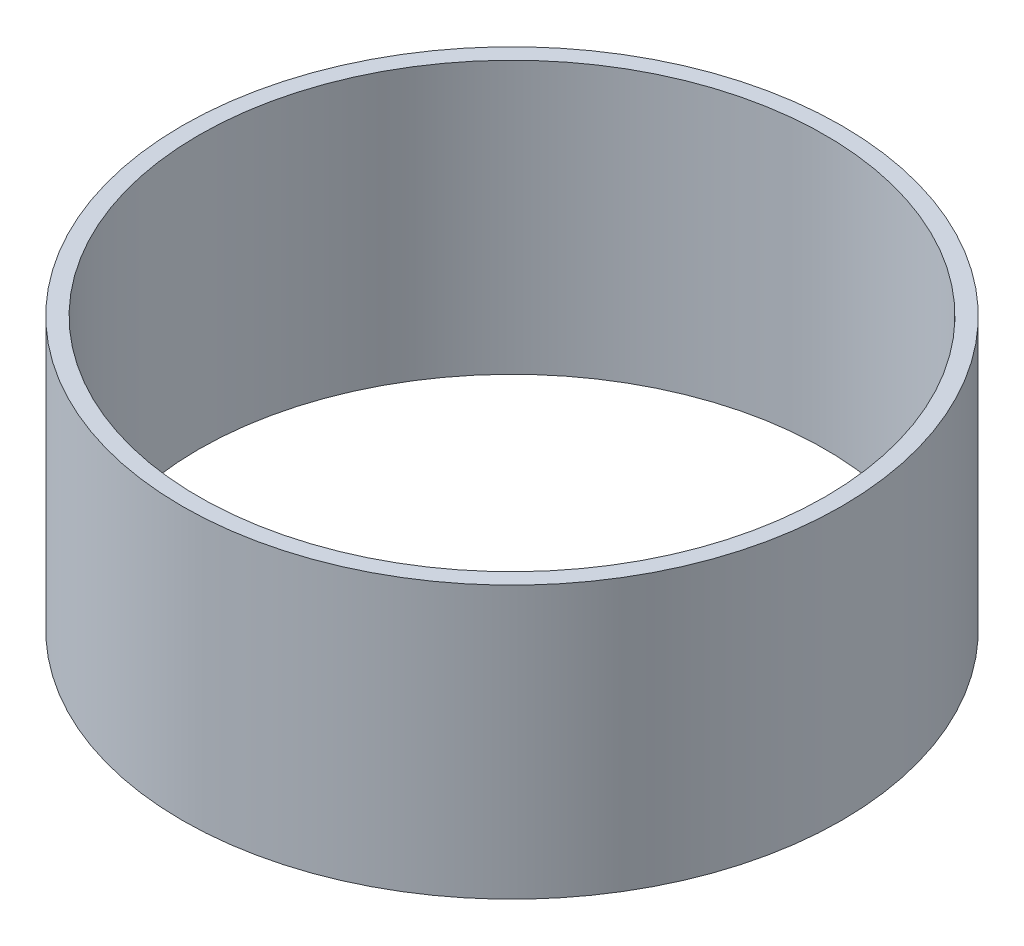
from build123d import *

# Parameters (mm, degrees)
SKETCH1_R           = 60
SKETCH1_R_2         = 57
EXTRUDE_THIN1_DEPTH = 49.5


with BuildPart() as part:
    # Sketch1 → Extrude-Thin1 (new body)
    with BuildSketch(Plane(origin=(0, 0, 0), x_dir=(1, 0, 0), z_dir=(0, 1, 0))):
        Circle(SKETCH1_R)
        Circle(SKETCH1_R_2, mode=Mode.SUBTRACT)
    extrude(amount=EXTRUDE_THIN1_DEPTH)


solid = part.part
